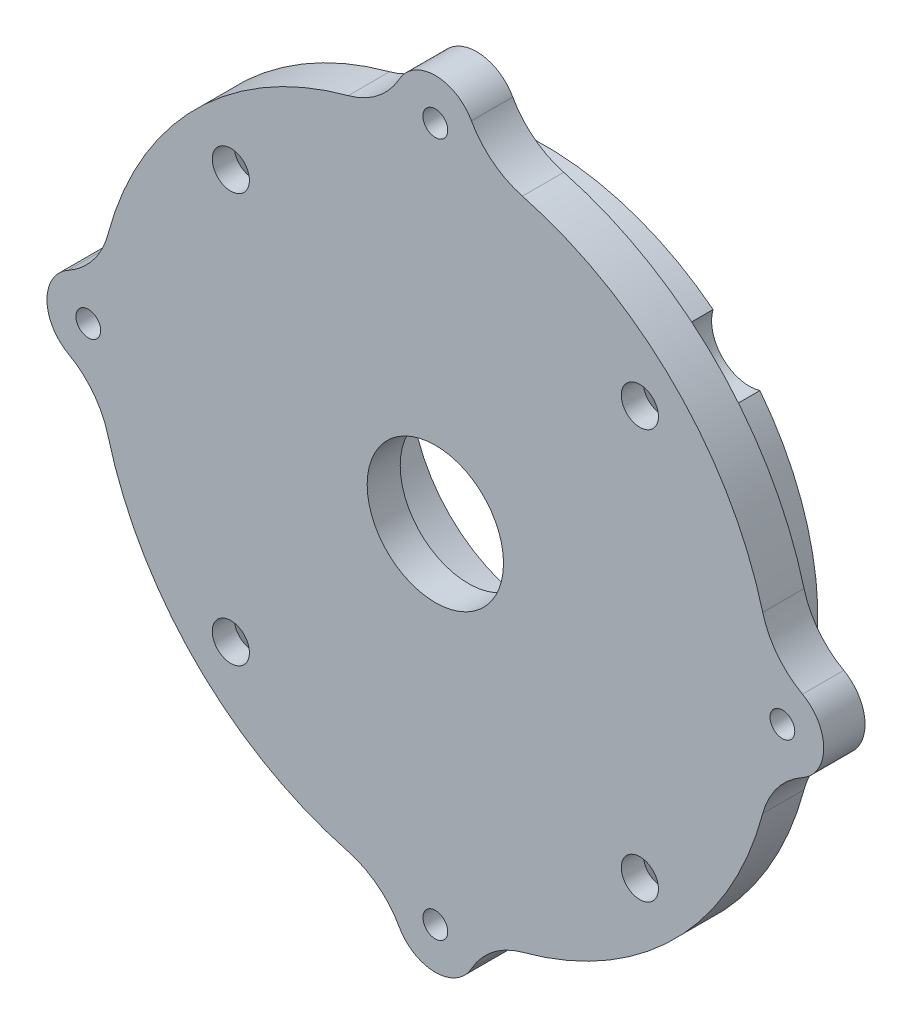
from build123d import *

# Parameters (mm, degrees)
IZIM1_R                                    = 22.5
IZIM1_R_2                                  = 16.25
Y_KSEKLIK_EKSTR_ZYON1_DEPTH                = 8.25
IZIM1_R_3                                  = 33.05
IZIM1_R_4                                  = 28
Y_KSEKLIK_EKSTR_ZYON1_2_DEPTH              = 8.25
IZIM2_R                                    = 2
IZIM2_R_2                                  = 1.5
IZIM2_R_3                                  = 8.25
Y_KSEKLIK_EKSTR_ZYON2_DEPTH                = 5
M4_ALT_GEN_ALYAN_HAV_A_BA_L_VIDA_I_2_COUNT = 2
M4_ALT_GEN_ALYAN_HAV_A_BA_L_VIDA_I_2_PITCH = 49.5
M4_ALT_GEN_ALYAN_HAV_A_BA_L_VIDA_I_3_COUNT = 2
M4_ALT_GEN_ALYAN_HAV_A_BA_L_VIDA_I_3_PITCH = 70.003571337
M4_ALT_GEN_ALYAN_HAV_A_BA_L_VIDA_I_4_COUNT = 2
M4_ALT_GEN_ALYAN_HAV_A_BA_L_VIDA_I_4_PITCH = 49.5
IZIM7_R                                    = 16.25
KES_EKSTR_ZYON2_DEPTH                      = 1
IZIM8_R                                    = 4.567222976
KES_EKSTR_ZYON3_DEPTH                      = 8.25


with BuildPart() as part:
    # Çizim1 → Yükseklik-Ekstrüzyon1 (new body)
    with BuildSketch(Plane.XY):
        Circle(IZIM1_R)
        Circle(IZIM1_R_2, mode=Mode.SUBTRACT)
    extrude(amount=Y_KSEKLIK_EKSTR_ZYON1_DEPTH)



with BuildPart() as body_2:
    # Çizim1 → Y_kseklik-Ekstr_zyon1 2 (new body)
    with BuildSketch(Plane.XY):
        Circle(IZIM1_R_3)
        Circle(IZIM1_R_4, mode=Mode.SUBTRACT)
    extrude(amount=Y_KSEKLIK_EKSTR_ZYON1_2_DEPTH)


with BuildPart() as part_1:
    add(part.part)

    add(body_2.part)  # Yükseklik-Ekstrüzyon2 merges body 2
    # Çizim2 → Yükseklik-Ekstrüzyon2 (add)
    with BuildSketch(Plane.XY.offset(8.25)):
        with BuildLine():
            ThreePointArc((-10.540830255, 39.621848739), (-28.991378029, 28.991378029), (-39.621848739, 10.540830255))
            ThreePointArc((-39.621848739, 10.540830255), (-41.396931543, 6.966269622), (-44.428571429, 4.370588155))
            ThreePointArc((-44.428571429, 4.370588155), (-47, 0), (-44.428571429, -4.370588155))
            ThreePointArc((-44.428571429, -4.370588155), (-41.396931543, -6.966269622), (-39.621848739, -10.540830255))
            ThreePointArc((-39.621848739, -10.540830255), (-28.991378029, -28.991378029), (-10.540830255, -39.621848739))
            ThreePointArc((-10.540830255, -39.621848739), (-6.966269622, -41.396931543), (-4.370588155, -44.428571429))
            ThreePointArc((-4.370588155, -44.428571429), (0, -47), (4.370588155, -44.428571429))
            ThreePointArc((4.370588155, -44.428571429), (6.966269622, -41.396931543), (10.540830255, -39.621848739))
            ThreePointArc((10.540830255, -39.621848739), (28.991378029, -28.991378029), (39.621848739, -10.540830255))
            ThreePointArc((39.621848739, -10.540830255), (41.396931543, -6.966269622), (44.428571429, -4.370588155))
            ThreePointArc((44.428571429, -4.370588155), (47, 0), (44.428571429, 4.370588155))
            ThreePointArc((44.428571429, 4.370588155), (41.396931543, 6.966269622), (39.621848739, 10.540830255))
            ThreePointArc((39.621848739, 10.540830255), (28.991378029, 28.991378029), (10.540830255, 39.621848739))
            ThreePointArc((10.540830255, 39.621848739), (6.966269622, 41.396931543), (4.370588155, 44.428571429))
            ThreePointArc((4.370588155, 44.428571429), (0, 47), (-4.370588155, 44.428571429))
            ThreePointArc((-4.370588155, 44.428571429), (-6.966269622, 41.396931543), (-10.540830255, 39.621848739))
        make_face()
        with Locations(Location((-24.75, 24.75, 0), (0, 0, 302.756106046))):
            Circle(IZIM2_R, mode=Mode.SUBTRACT)
        with Locations(Location((24.75, 24.75, 0), (0, 0, 212.756106046))):
            Circle(IZIM2_R, mode=Mode.SUBTRACT)
        with Locations(Location((24.75, -24.75, 0), (0, 0, 147.243893954))):
            Circle(IZIM2_R, mode=Mode.SUBTRACT)
        with Locations(Location((-24.75, -24.75, 0), (0, 0, 57.243893954))):
            Circle(IZIM2_R, mode=Mode.SUBTRACT)
        with Locations((0, 42)):
            Circle(IZIM2_R_2, mode=Mode.SUBTRACT)
        with Locations((42, 0)):
            Circle(IZIM2_R_2, mode=Mode.SUBTRACT)
        with Locations((0, -42)):
            Circle(IZIM2_R_2, mode=Mode.SUBTRACT)
        with Locations((-42, 0)):
            Circle(IZIM2_R_2, mode=Mode.SUBTRACT)
        Circle(IZIM2_R_3, mode=Mode.SUBTRACT)
    extrude(amount=Y_KSEKLIK_EKSTR_ZYON2_DEPTH)

    # Çizim5 → M4 Altıgen Alyan Havşa Başlı Vida İçin Havşa2 (revolve, cut)
    with BuildSketch(Plane(origin=(24.75, 24.75, 8.25), x_dir=(0, 1, 0), z_dir=(1, 0, 0))):
        Polygon((0, 0), (0, 5), (2.25, 5), (2.25, 2.34), (4.59, 0), align=None)
    m4_alt_gen_alyan_hav_a_ba_l_vida_in_ha = revolve(axis=Axis((24.75, 24.75, 1.9), (0, 0, 1)), mode=Mode.SUBTRACT)

    # M4 Alt_gen Alyan Hav_a Ba_l_ Vida _i 2: M4 Altıgen Alyan Havşa Başlı Vida İçin Havşa2 ×2
    with Locations(*[(-i * M4_ALT_GEN_ALYAN_HAV_A_BA_L_VIDA_I_2_PITCH, 0, 0) for i in range(1, M4_ALT_GEN_ALYAN_HAV_A_BA_L_VIDA_I_2_COUNT)]):
        add(m4_alt_gen_alyan_hav_a_ba_l_vida_in_ha, mode=Mode.SUBTRACT)

    # M4 Alt_gen Alyan Hav_a Ba_l_ Vida _i 3: M4 Altıgen Alyan Havşa Başlı Vida İçin Havşa2 ×2
    with Locations(*[Vector(-0.7071067811865475, -0.7071067811865476, 0) * (i * M4_ALT_GEN_ALYAN_HAV_A_BA_L_VIDA_I_3_PITCH) for i in range(1, M4_ALT_GEN_ALYAN_HAV_A_BA_L_VIDA_I_3_COUNT)]):
        add(m4_alt_gen_alyan_hav_a_ba_l_vida_in_ha, mode=Mode.SUBTRACT)

    # M4 Alt_gen Alyan Hav_a Ba_l_ Vida _i 4: M4 Altıgen Alyan Havşa Başlı Vida İçin Havşa2 ×2
    with Locations(*[(0, -i * M4_ALT_GEN_ALYAN_HAV_A_BA_L_VIDA_I_4_PITCH, 0) for i in range(1, M4_ALT_GEN_ALYAN_HAV_A_BA_L_VIDA_I_4_COUNT)]):
        add(m4_alt_gen_alyan_hav_a_ba_l_vida_in_ha, mode=Mode.SUBTRACT)

    # Çizim7 → Kes-Ekstrüzyon2 (cut)
    with BuildSketch(Plane(origin=(0, 0, 8.25), x_dir=(-1, 0, 0), z_dir=(0, 0, -1))):
        Circle(IZIM7_R)
    extrude(amount=-KES_EKSTR_ZYON2_DEPTH, mode=Mode.SUBTRACT)

    # Çizim8 → Kes-Ekstrüzyon3 (cut)
    with BuildSketch(Plane(origin=(0, 0, 0), x_dir=(-1, 0, 0), z_dir=(0, 0, -1))):
        with Locations((-24.75, 24.75)):
            Circle(IZIM8_R)
        with Locations((24.75, 24.75)):
            Circle(IZIM8_R)
        with Locations((24.75, -24.75)):
            Circle(IZIM8_R)
        with Locations((-24.75, -24.75)):
            Circle(IZIM8_R)
    extrude(amount=-KES_EKSTR_ZYON3_DEPTH, mode=Mode.SUBTRACT)


solid = part_1.part
